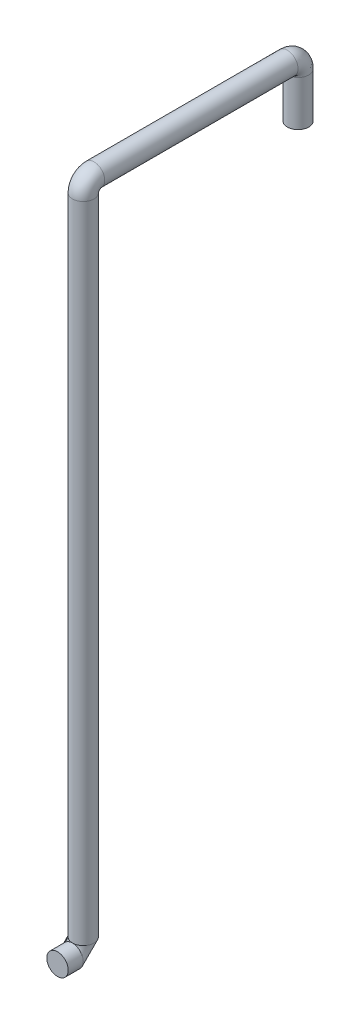
from build123d import *

# Parameters (mm, degrees)
CROQUIS1_R              = 50
SALIENTE_EXTRUIR1_DEPTH = 10
CROQUIS2_R              = 50


with BuildPart() as part:
    # Croquis1 → Saliente-Extruir1 (new body)
    with BuildSketch(Plane(origin=(0, 0, 0), x_dir=(1, 0, 0), z_dir=(0, 1, 0))):
        with Locations(Location((0, 0, 0), (0, 0, 270))):
            Circle(CROQUIS1_R)
    extrude(amount=SALIENTE_EXTRUIR1_DEPTH)

    # Barrer1: sweep along a curve in space
    with BuildLine() as barrer1_path:
        Line((0, 10, 0), (0, 210, 0))
        ThreePointArc((0, 210, 0), (0, 245.355339059, 14.644660941), (0, 260, 50))
        Line((0, 260, 50), (0, 260, 950))
        ThreePointArc((0, 260, 950), (0, 245.355339059, 985.355339059), (0, 210, 1000))
        Line((0, 210, 1000), (0, -2790, 1000))
        ThreePointArc((0, -2790, 1000), (0, -2825.355339059, 1014.644660941), (0, -2840, 1050))
        Line((0, -2840, 1050), (0, -2840, 1120))
    # Croquis2 → Barrer1 (sweep)
    with BuildSketch(Plane(origin=(0, 10, 0), x_dir=(1, 0, 0), z_dir=(0, 1, 0))):
        Circle(CROQUIS2_R)
    sweep(path=barrer1_path.line)


solid = part.part
